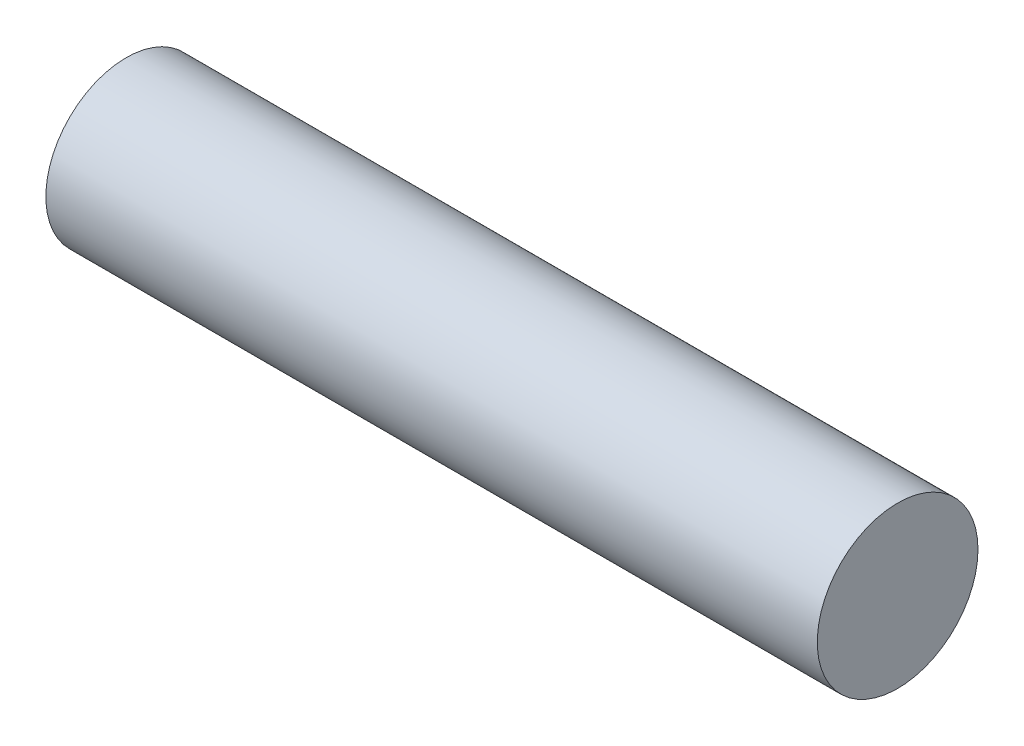
from build123d import *

# Parameters (mm, degrees)
SKETCH1_R           = 1.5875
BOSS_EXTRUDE1_DEPTH = 7.62


with BuildPart() as part:
    # Sketch1 → Boss-Extrude1 (new, symmetric)
    with BuildSketch(Plane(origin=(0, 0, 0), x_dir=(0, 0, -1), z_dir=(1, 0, 0))):
        Circle(SKETCH1_R)
    extrude(amount=BOSS_EXTRUDE1_DEPTH, both=True)


solid = part.part
